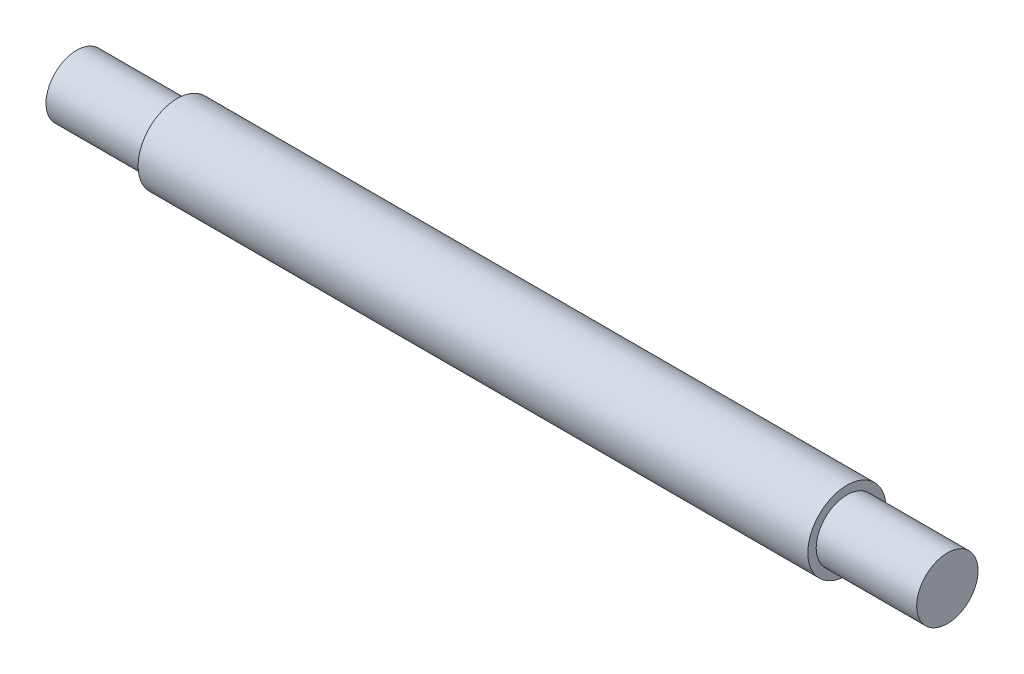
from build123d import *


with BuildPart() as part:
    # Sketch1 → Revolve1 (revolve)
    with BuildSketch(Plane(origin=(0, 0, 0), x_dir=(1, 0, 0), z_dir=(0, 1, 0)), mode=Mode.PRIVATE) as revolve1_sk:
        Polygon((0, 0), (156, 0), (156, 5.5), (138, 5.5), (138, 7), (18, 7), (18, 5.5), (0, 5.5), align=None)
    revolve(revolve1_sk.sketch.rotate(Axis((0, 0, 0), (1, 0, 0)), 180), axis=Axis((0, 0, 0), (1, 0, 0)))


solid = part.part
